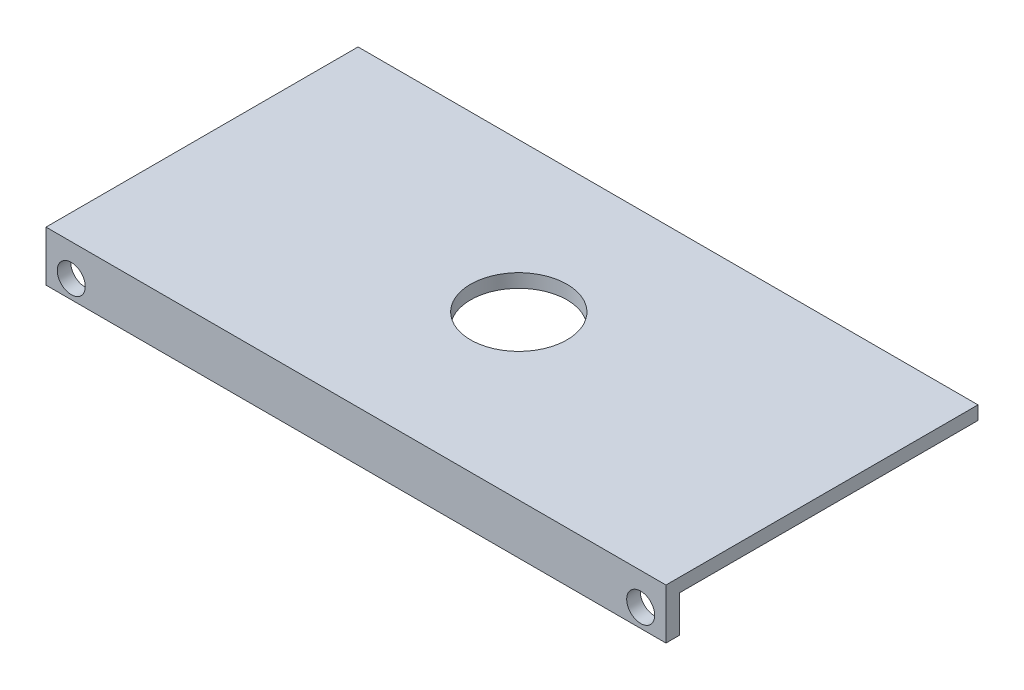
from build123d import *

# Parameters (mm, degrees)
SKETCH_1_W          = 68.58
SKETCH_1_H          = 4.064
SKETCH_1_R          = 1.55
EXTRUDE_2_DEPTH     = 1.5
SKETCH_3_W          = 68.58
SKETCH_3_H          = 1.5
EXTRUDE_3_DEPTH     = 1.5
SKETCH_4_W          = 68.58
SKETCH_4_H          = 1.5
EXTRUDE_4_DEPTH     = 33.02
SKETCH_5_R          = 5.334
CUT_EXTRUDE_2_DEPTH = 33.02


with BuildPart() as part:
    # 草图1 → 凸台-拉伸2 (new body)
    with BuildSketch(Plane.XY):
        Rectangle(SKETCH_1_W, SKETCH_1_H)
        with Locations((31.496, 0)):
            Circle(SKETCH_1_R, mode=Mode.SUBTRACT)
        with Locations((-31.496, 0)):
            Circle(SKETCH_1_R, mode=Mode.SUBTRACT)
    extrude(amount=EXTRUDE_2_DEPTH)

    # 草图3 → 凸台-拉伸3 (add)
    with BuildSketch(Plane(origin=(0, 2.032, 0), x_dir=(1, 0, 0), z_dir=(0, 1, 0))):
        with Locations((0, -0.75)):
            Rectangle(SKETCH_3_W, SKETCH_3_H)
    extrude(amount=EXTRUDE_3_DEPTH)

    # 草图4 → 凸台-拉伸4 (add)
    with BuildSketch(Plane(origin=(0, 0, 0), x_dir=(-1, 0, 0), z_dir=(0, 0, -1))):
        with Locations((0, 2.782)):
            Rectangle(SKETCH_4_W, SKETCH_4_H)
    extrude(amount=EXTRUDE_4_DEPTH)

    # 草图5 → 切除-拉伸2 (cut)
    with BuildSketch(Plane.XZ.offset(-2.032)):
        with Locations(Location((0, -16.51, 0), (0, 0, 270))):
            Circle(SKETCH_5_R)
    extrude(amount=-CUT_EXTRUDE_2_DEPTH, mode=Mode.SUBTRACT)


solid = part.part
